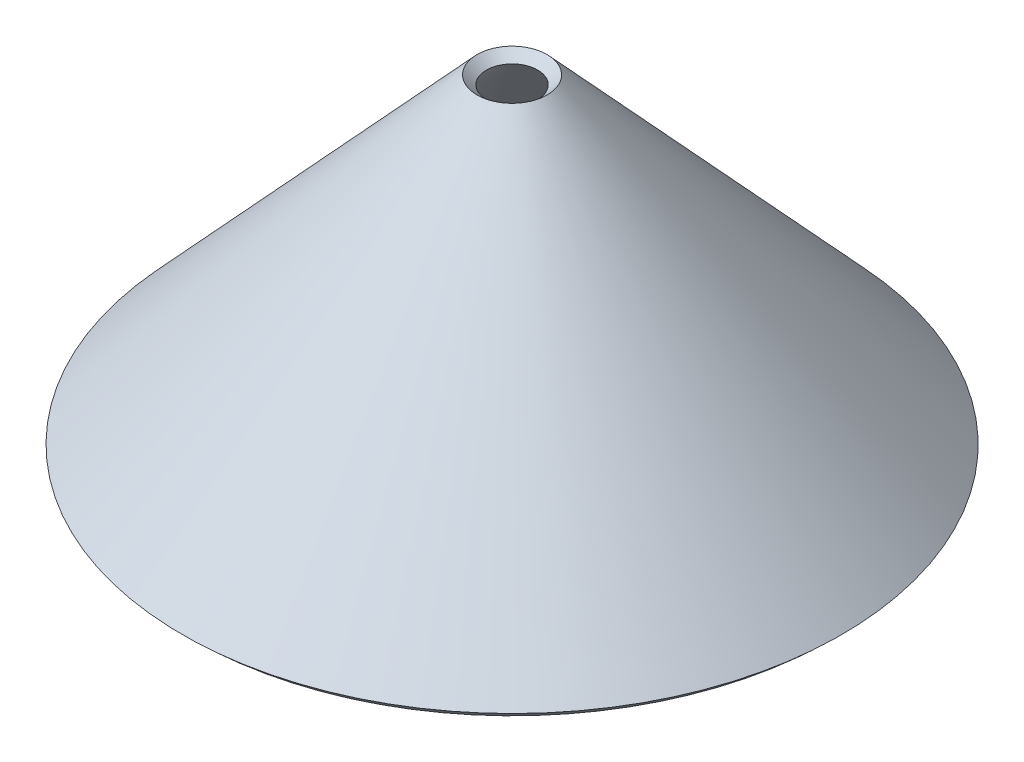
from build123d import *


with BuildPart() as part:
    # Sketch1 → Revolve-Thin2 (revolve)
    with BuildSketch(Plane(origin=(0, 0, 0), x_dir=(0, 0, -1), z_dir=(1, 0, 0)), mode=Mode.PRIVATE) as revolve_thin2_sk:
        Polygon((-50.8, 0), (-635, -635), (-653.692647699, -617.802764117), (-69.492647699, 17.197235883), align=None)
    revolve(revolve_thin2_sk.sketch.rotate(Axis((0, 0, 0), (0, -1, 0)), 180), axis=Axis((0, 0, 0), (0, -1, 0)))


solid = part.part
